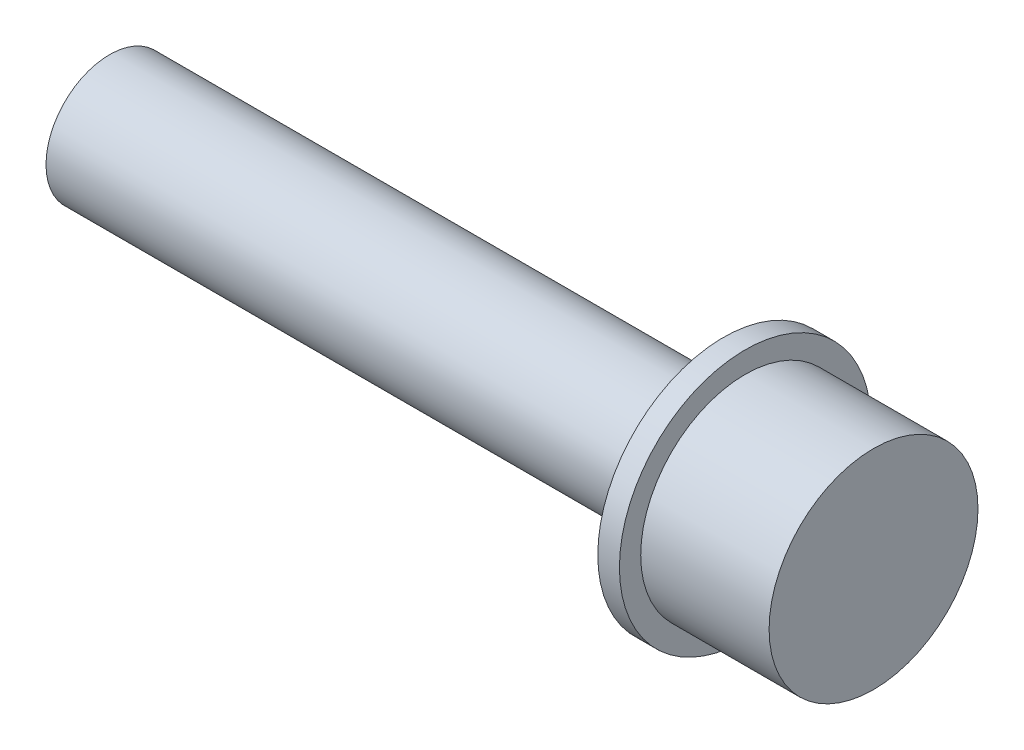
from build123d import *

# Parameters (mm, degrees)
SKETCH1_R           = 4.93
BOSS_EXTRUDE1_DEPTH = 6.06
SKETCH2_R           = 3
BOSS_EXTRUDE2_DEPTH = 30
SKETCH3_R           = 5.935
BOSS_EXTRUDE3_DEPTH = 1.02


with BuildPart() as part:
    # Sketch1 → Boss-Extrude1 (new body)
    with BuildSketch(Plane(origin=(0, 0, 0), x_dir=(0, 0, -1), z_dir=(1, 0, 0))):
        Circle(SKETCH1_R)
    extrude(amount=BOSS_EXTRUDE1_DEPTH)

    # Sketch2 → Boss-Extrude2 (add)
    with BuildSketch(Plane.ZY):
        Circle(SKETCH2_R)
    extrude(amount=BOSS_EXTRUDE2_DEPTH)

    # Sketch3 → Boss-Extrude3 (add)
    with BuildSketch(Plane.ZY):
        Circle(SKETCH3_R)
    extrude(amount=BOSS_EXTRUDE3_DEPTH)


solid = part.part
